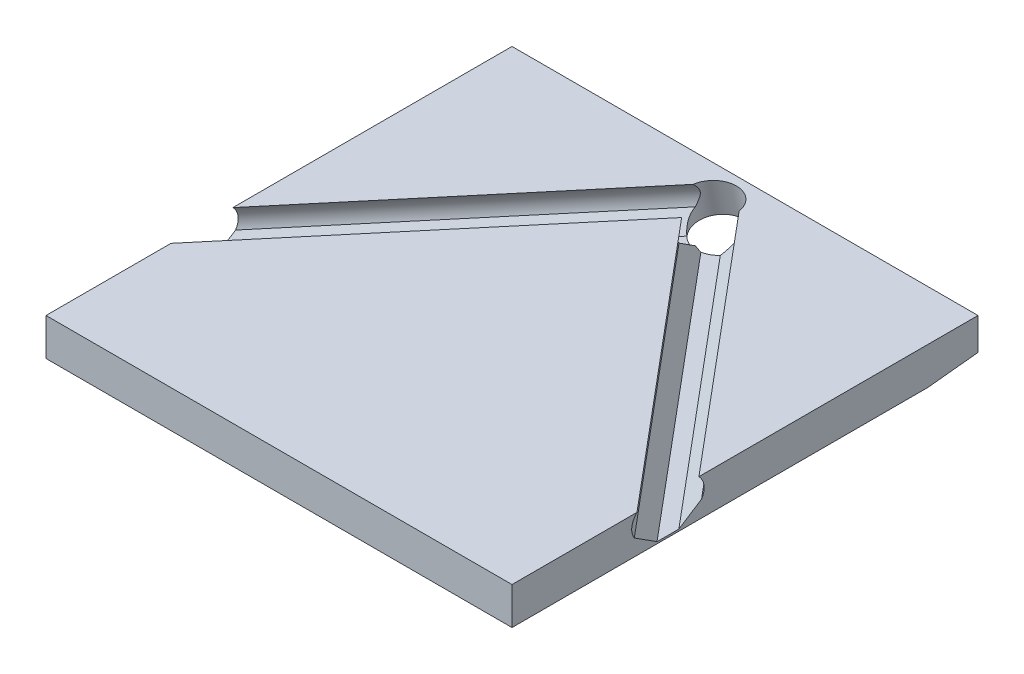
from build123d import *

# Parameters (mm, degrees)
SKETCH1_W               = 250
SKETCH1_H               = 250
BOSS_EXTRUDE1_DEPTH     = 20
CUT_EXTRUDE1_DEPTH      = 281.223125384
CUT_EXTRUDE2_DEPTH      = 184.527379594
CUT_EXTRUDE2_DEPTH_BACK = 184.527379594
SKETCH3_R               = 12.5
CUT_EXTRUDE3_DEPTH      = 261.116460281
CUT_EXTRUDE5_DEPTH      = 261.116460289


with BuildPart() as part:
    # Sketch1 → Boss-Extrude1 (new body)
    with BuildSketch(Plane(origin=(0, 0, 0), x_dir=(1, 0, 0), z_dir=(0, 1, 0))):
        Rectangle(SKETCH1_W, SKETCH1_H)
    extrude(amount=BOSS_EXTRUDE1_DEPTH)

    # Sketch2 → Cut-Extrude1 (cut, through all)
    with BuildSketch(Plane(origin=(125, 0, 0), x_dir=(0, 0, -1), z_dir=(1, 0, 0))):
        Polygon((125, 2.822268508), (125, 0), (98.147908825, 0), align=None)
    extrude(amount=-CUT_EXTRUDE1_DEPTH, mode=Mode.SUBTRACT)

    # Sketch3 → Cut-Extrude2 (cut, two sides: drawn at the far end of the back side and taken through both)
    with BuildSketch(Plane(origin=(0, -20.175156681, -3.23125924), x_dir=(1, 0, 0), z_dir=(0, -0.9781476007338071, -0.20791169081775307)).offset(-CUT_EXTRUDE2_DEPTH_BACK)):
        with Locations((0, -110.463189586)):
            Circle(SKETCH3_R)
    extrude(amount=CUT_EXTRUDE2_DEPTH + CUT_EXTRUDE2_DEPTH_BACK, mode=Mode.SUBTRACT)

    # Sketch4 → Cut-Extrude3 (cut, through all)
    with BuildSketch(Plane(origin=(56.770360605, 0, -59.986780379), x_dir=(0.7660444431189859, 0, 0.6427876096865301), z_dir=(-0.6427876096865301, 0, 0.7660444431189859))):
        with BuildLine():
            Line((-84.785520804, 20), (-63.4313643, 20))
            ThreePointArc((-63.4313643, 20), (-61.650530379, 14.524902088), (-62.512612953, 8.832373631))
            Line((-62.512612953, 8.832373631), (-70.344986584, 1))
            Line((-70.344986584, 1), (-77.871898519, 1))
            Line((-77.871898519, 1), (-85.704272151, 8.832373631))
            ThreePointArc((-85.704272151, 8.832373631), (-86.566354725, 14.524902088), (-84.785520804, 20))
        make_face()
    extrude(amount=CUT_EXTRUDE3_DEPTH, mode=Mode.SUBTRACT)

    # Sketch9 → Cut-Extrude5 (cut, through all)
    with BuildSketch(Plane(origin=(-56.770360605, 0, -59.986780379), x_dir=(-0.766044443118977, 0, 0.6427876096865405), z_dir=(-0.6427876096865405, 0, -0.766044443118977))):
        with BuildLine():
            Line((-63.4313643, 20), (-84.785520804, 20))
            ThreePointArc((-84.785520804, 20), (-86.566354725, 14.524902088), (-85.704272151, 8.832373631))
            Line((-85.704272151, 8.832373631), (-77.871898519, 1))
            Line((-77.871898519, 1), (-70.344986584, 1))
            Line((-70.344986584, 1), (-62.512612953, 8.832373631))
            ThreePointArc((-62.512612953, 8.832373631), (-61.650530379, 14.524902088), (-63.4313643, 20))
        make_face()
    extrude(amount=-CUT_EXTRUDE5_DEPTH, mode=Mode.SUBTRACT)


solid = part.part
